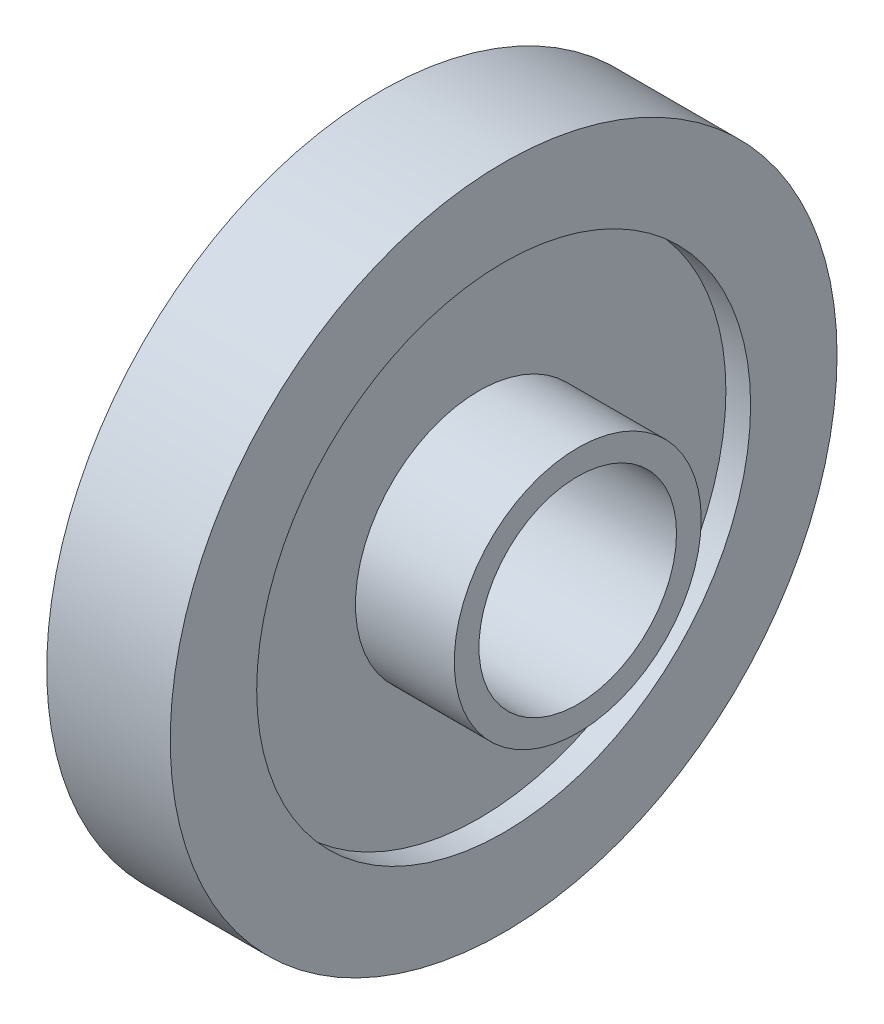
from build123d import *

# Parameters (mm, degrees)
CROQUIS1_R              = 13.5
SALIENTE_EXTRUIR1_DEPTH = 5
CROQUIS2_R              = 10
CORTAR_EXTRUIR1_DEPTH   = 1
CORTAR_EXTRUIR2_START   = -1
CROQUIS3_R              = 10
CORTAR_EXTRUIR2_DEPTH   = 1
CROQUIS4_R              = 5
SALIENTE_EXTRUIR2_DEPTH = 4
CROQUIS5_R              = 4
CORTAR_EXTRUIR4_DEPTH   = 21.700241544


with BuildPart() as part:
    # Croquis1 → Saliente-Extruir1 (new body)
    with BuildSketch(Plane(origin=(0, 0, 0), x_dir=(0, 0, -1), z_dir=(1, 0, 0))):
        Circle(CROQUIS1_R)
    extrude(amount=SALIENTE_EXTRUIR1_DEPTH)

    # Croquis2 → Cortar-Extruir1 (cut)
    with BuildSketch(Plane(origin=(5, 0, 0), x_dir=(0, 0, -1), z_dir=(1, 0, 0))):
        Circle(CROQUIS2_R)
    extrude(amount=-CORTAR_EXTRUIR1_DEPTH, mode=Mode.SUBTRACT)

    # Croquis3 → Cortar-Extruir2 (cut)
    with BuildSketch(Plane.ZY.offset(CORTAR_EXTRUIR2_START)):
        with Locations(Location((0, 0, 0), (0, 0, 180))):
            Circle(CROQUIS3_R)
    extrude(amount=CORTAR_EXTRUIR2_DEPTH, mode=Mode.SUBTRACT)

    # Croquis4 → Saliente-Extruir2 (add)
    with BuildSketch(Plane(origin=(4, 0, 0), x_dir=(0, 0, -1), z_dir=(1, 0, 0))):
        Circle(CROQUIS4_R)
    extrude(amount=SALIENTE_EXTRUIR2_DEPTH)

    # Croquis5 → Cortar-Extruir4 (cut, through all)
    with BuildSketch(Plane(origin=(8, 0, 0), x_dir=(0, 0, -1), z_dir=(1, 0, 0))):
        Circle(CROQUIS5_R)
    extrude(amount=-CORTAR_EXTRUIR4_DEPTH, mode=Mode.SUBTRACT)


solid = part.part
